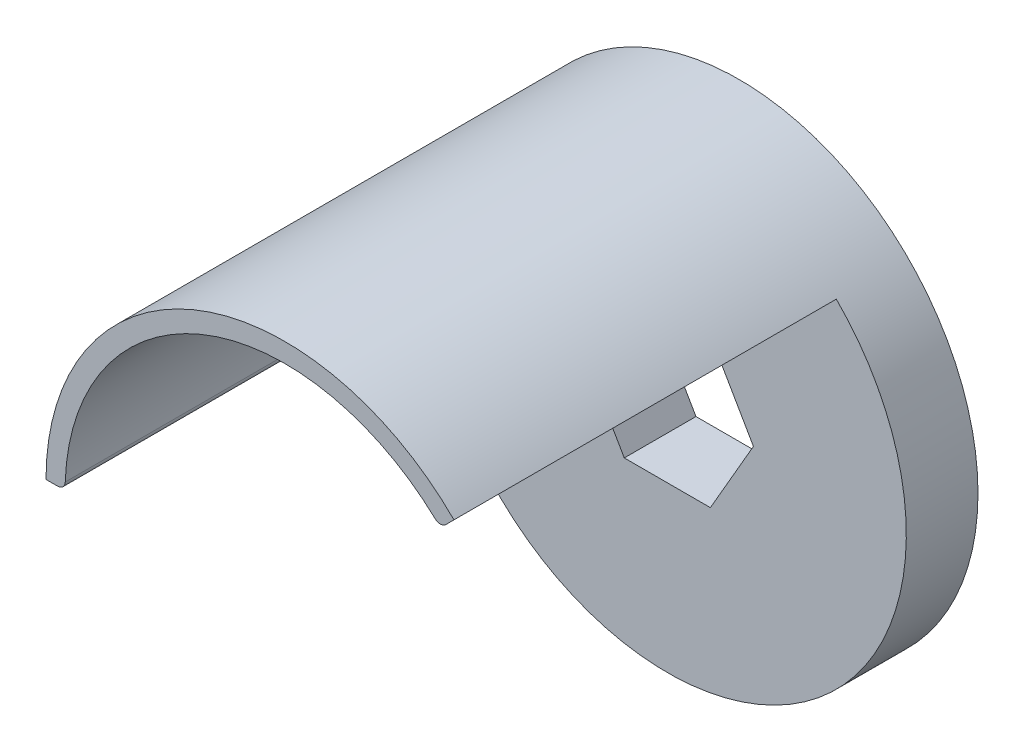
from build123d import *
from build123d.topology import SkipClean

# Parameters (mm, degrees)
SKETCH1_R           = 15.875
BOSS_EXTRUDE1_DEPTH = 4.7625
BOSS_EXTRUDE2_DEPTH = 25.4
FILLET1_R           = 0.508


with BuildPart() as part:
    # Sketch1 → Boss-Extrude1 (new body)
    with BuildSketch(Plane.XY):
        with Locations(Location((0, 0, 0), (0, 0, 180))):
            Circle(SKETCH1_R)
        Polygon((5.719231767, 0), (2.859615883, 4.953), (-2.859615883, 4.953), (-5.719231767, 0), (-2.859615883, -4.953), (2.859615883, -4.953), align=None, mode=Mode.SUBTRACT)
    extrude(amount=BOSS_EXTRUDE1_DEPTH)

    # Sketch2 → Boss-Extrude2 (add)
    with SkipClean():  # the faces are left unmerged after this step: merging them gives an invalid solid
        with BuildSketch(Plane.XY.offset(4.7625)):
            with BuildLine():
                Line((-15.875, 0), (-14.605, 0))
                ThreePointArc((-14.605, 0), (-5.58909153, 13.493260572), (10.327294539, 10.327294539))
                Line((10.327294539, 10.327294539), (11.225320151, 11.225320151))
                ThreePointArc((11.225320151, 11.225320151), (-6.075099489, 14.666587579), (-15.875, 0))
            make_face()
        extrude(amount=BOSS_EXTRUDE2_DEPTH)

    # Fillet1
    fillet1_edges = [part.edges().sort_by_distance(p)[0] for p in [
        (-14.605, 0, 17.4625),
        (10.327294539, 10.327294539, 17.4625),
    ]]
    fillet(fillet1_edges, radius=FILLET1_R)


solid = part.part
